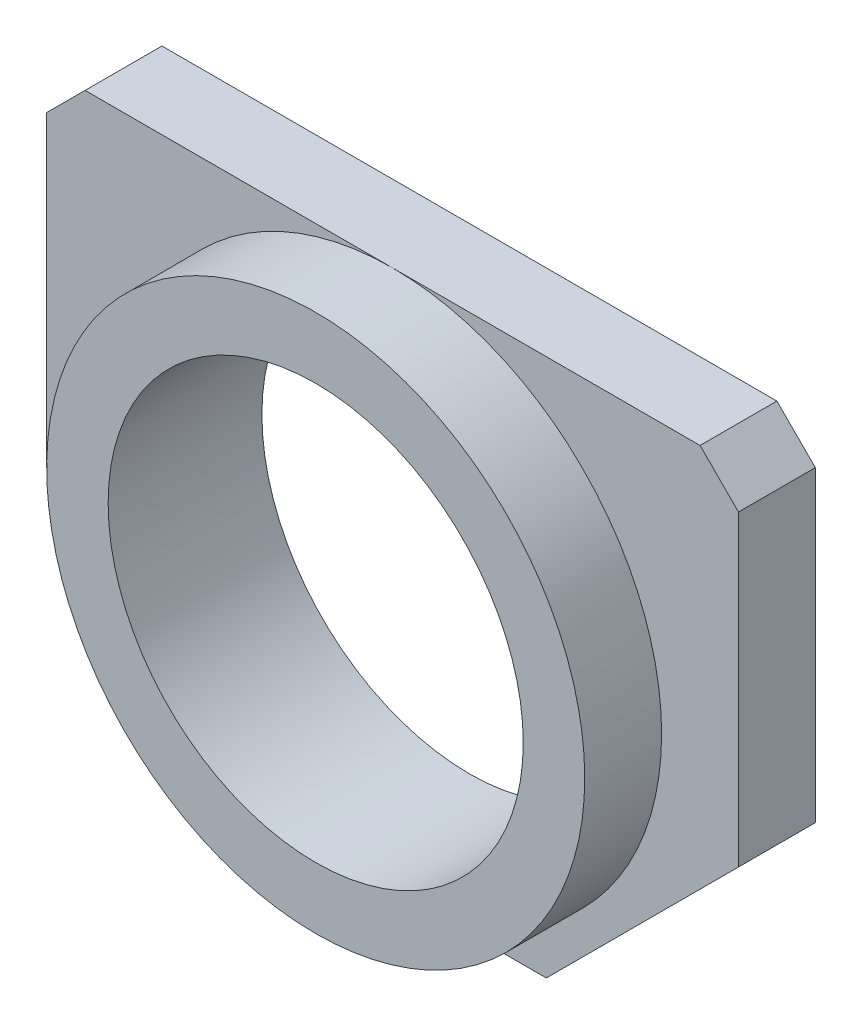
from build123d import *

# Parameters (mm, degrees)
SKETCH1_W                   = 18
SKETCH1_H                   = 14
BOSS_EXTRUDE1_DEPTH         = 2
SKETCH2_R                   = 7
BOSS_EXTRUDE2_DEPTH         = 2
M12X1_25_TAPPED_HOLE1_D     = 10.8
M12X1_25_TAPPED_HOLE1_DEPTH = 8.75
M12X1_25_TAPPED_HOLE1_TIP   = 3.244647343
CHAMFER6_SIZE               = 5
CHAMFER7_SIZE               = 1


with BuildPart() as part:
    # Sketch1 → Boss-Extrude1 (new body)
    with BuildSketch(Plane.XY):
        Rectangle(SKETCH1_W, SKETCH1_H)
    extrude(amount=BOSS_EXTRUDE1_DEPTH)

    # Sketch2 → Boss-Extrude2 (add)
    with BuildSketch(Plane.XY.offset(2)):
        with Locations(Location((0, 0, 0), (0, 0, 270))):
            Circle(SKETCH2_R)
    extrude(amount=BOSS_EXTRUDE2_DEPTH)

    # M12x1.25 Tapped Hole1
    with Locations(Plane.XY.offset(4)):
        with Locations((0, 0)):
            Hole(M12X1_25_TAPPED_HOLE1_D / 2, depth=M12X1_25_TAPPED_HOLE1_DEPTH)
            with Locations((0, 0, -(M12X1_25_TAPPED_HOLE1_DEPTH + M12X1_25_TAPPED_HOLE1_TIP / 2))):  # 118° drill point
                Cone(0, M12X1_25_TAPPED_HOLE1_D / 2, M12X1_25_TAPPED_HOLE1_TIP, mode=Mode.SUBTRACT)

    # Chamfer6
    chamfer6_edges = [part.edges().sort_by_distance(p)[0] for p in [
        (9, -7, 1),
        (-9, -7, 1),
    ]]
    chamfer(chamfer6_edges, length=CHAMFER6_SIZE)

    # Chamfer7
    chamfer7_edges = [part.edges().sort_by_distance(p)[0] for p in [
        (-9, 7, 1),
        (9, 7, 1),
    ]]
    chamfer(chamfer7_edges, length=CHAMFER7_SIZE)


solid = part.part
